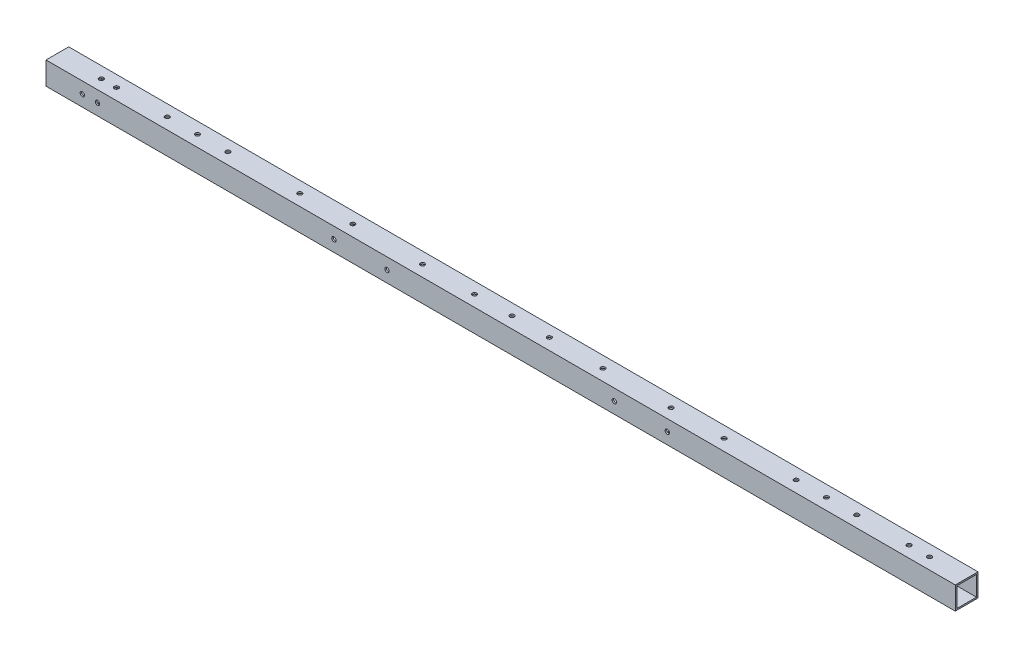
from build123d import *

# Parameters (mm, degrees)
SKETCH_1_W          = 15
SKETCH_1_H          = 15
SKETCH_1_W_2        = 13
SKETCH_1_H_2        = 13
EXTRUDE_1_DEPTH     = 600
SKETCH_3_R          = 1.45
CUT_EXTRUDE_2_DEPTH = 601.234329242
SKETCH_4_R          = 1.45
CUT_EXTRUDE_3_DEPTH = 601.234329242


with BuildPart() as part:
    # 草图1 → 凸台-拉伸1 (new body)
    with BuildSketch(Plane(origin=(0, 0, 0), x_dir=(0, 0, -1), z_dir=(1, 0, 0))):
        Rectangle(SKETCH_1_W, SKETCH_1_H)
        Rectangle(SKETCH_1_W_2, SKETCH_1_H_2, mode=Mode.SUBTRACT)
    extrude(amount=EXTRUDE_1_DEPTH)

    # 草图3 → 切除-拉伸2 (cut, through all)
    with BuildSketch(Plane(origin=(0, 0, -7.5), x_dir=(-1, 0, 0), z_dir=(0, 0, -1))):
        with Locations((-375, 0)):
            Circle(SKETCH_3_R)
        with Locations((-410, 0)):
            Circle(SKETCH_3_R)
        with Locations((-190, 0)):
            Circle(SKETCH_3_R)
        with Locations((-225, 0)):
            Circle(SKETCH_3_R)
        with Locations((-34, 0)):
            Circle(SKETCH_3_R)
        with Locations((-24, 0)):
            Circle(SKETCH_3_R)
    extrude(amount=-CUT_EXTRUDE_2_DEPTH, mode=Mode.SUBTRACT)

    # 草图4 → 切除-拉伸3 (cut, through all)
    with BuildSketch(Plane(origin=(0, 7.5, 0), x_dir=(1, 0, 0), z_dir=(0, 1, 0))):
        with Locations(Location((575.5, 0, 0), (0, 0, 270))):
            Circle(SKETCH_4_R)
        with Locations(Location((562, 0, 0), (0, 0, 270))):
            Circle(SKETCH_4_R)
        with Locations(Location((440, 0, 0), (0, 0, 270))):
            Circle(SKETCH_4_R)
        with Locations(Location((405, 0, 0), (0, 0, 270))):
            Circle(SKETCH_4_R)
        with Locations(Location((324.7, 0, 0), (0, 0, 270))):
            Circle(SKETCH_4_R)
        with Locations(Location((300, 0, 0), (0, 0, 270))):
            Circle(SKETCH_4_R)
        with Locations(Location((275.3, 0, 0), (0, 0, 270))):
            Circle(SKETCH_4_R)
        with Locations(Location((195, 0, 0), (0, 0, 270))):
            Circle(SKETCH_4_R)
        with Locations(Location((160, 0, 0), (0, 0, 270))):
            Circle(SKETCH_4_R)
        with Locations(Location((39, 0, 0), (0, 0, 270))):
            Circle(SKETCH_4_R)
        with Locations(Location((29, 0, 0), (0, 0, 270))):
            Circle(SKETCH_4_R)
        with Locations(Location((527.5, 0, 0), (0, 0, 270))):
            Circle(SKETCH_4_R)
        with Locations(Location((507.5, 0, 0), (0, 0, 270))):
            Circle(SKETCH_4_R)
        with Locations(Location((487.5, 0, 0), (0, 0, 270))):
            Circle(SKETCH_4_R)
        with Locations(Location((112.5, 0, 0), (0, 0, 270))):
            Circle(SKETCH_4_R)
        with Locations(Location((92.5, 0, 0), (0, 0, 270))):
            Circle(SKETCH_4_R)
        with Locations(Location((72.5, 0, 0), (0, 0, 270))):
            Circle(SKETCH_4_R)
        with Locations(Location((360, 0, 0), (0, 0, 270))):
            Circle(SKETCH_4_R)
        with Locations(Location((241, 0, 0), (0, 0, 270))):
            Circle(SKETCH_4_R)
    extrude(amount=-CUT_EXTRUDE_3_DEPTH, mode=Mode.SUBTRACT)


solid = part.part
